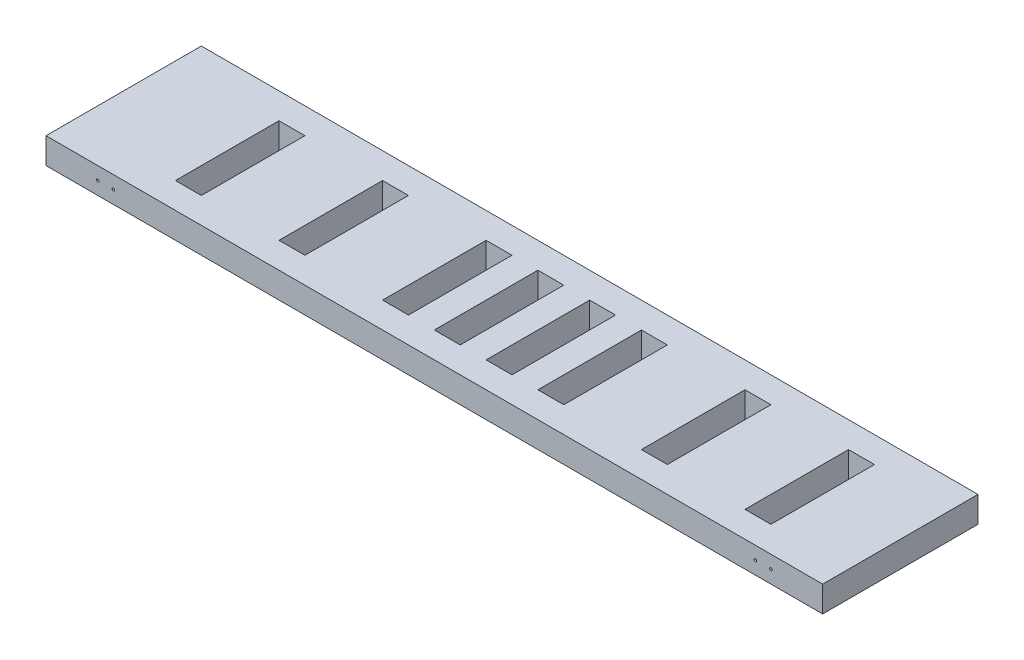
from build123d import *

# Parameters (mm, degrees)
SKETCH1_W           = 1500
SKETCH1_H           = 300
BOSS_EXTRUDE1_DEPTH = 50
SKETCH2_R           = 2.5
CUT_EXTRUDE1_DEPTH  = 50
SKETCH3_W           = 50
SKETCH3_H           = 200
CUT_EXTRUDE2_DEPTH  = 767.485485838


with BuildPart() as part:
    # Sketch1 → Boss-Extrude1 (new body)
    with BuildSketch(Plane(origin=(0, 0, 0), x_dir=(1, 0, 0), z_dir=(0, 1, 0))):
        Rectangle(SKETCH1_W, SKETCH1_H)
    extrude(amount=BOSS_EXTRUDE1_DEPTH)

    # Sketch2 → Cut-Extrude1 (cut)
    with BuildSketch(Plane.XY.offset(150)):
        with Locations((-650, 25)):
            Circle(SKETCH2_R)
        with Locations((-620, 25)):
            Circle(SKETCH2_R)
        with Locations((620, 25)):
            Circle(SKETCH2_R)
        with Locations((650, 25)):
            Circle(SKETCH2_R)
    extrude(amount=-CUT_EXTRUDE1_DEPTH, mode=Mode.SUBTRACT)

    # Sketch3 → Cut-Extrude2 (cut, through all)
    with BuildSketch(Plane(origin=(0, 50, 0), x_dir=(1, 0, 0), z_dir=(0, 1, 0))):
        with Locations((-525, 0)):
            Rectangle(SKETCH3_W, SKETCH3_H)
        with Locations((-325, 0)):
            Rectangle(SKETCH3_W, SKETCH3_H)
        with Locations((-125, 0)):
            Rectangle(SKETCH3_W, SKETCH3_H)
        with Locations((-25, 0)):
            Rectangle(SKETCH3_W, SKETCH3_H)
        with Locations((75, 0)):
            Rectangle(SKETCH3_W, SKETCH3_H)
        with Locations((175, 0)):
            Rectangle(SKETCH3_W, SKETCH3_H)
        with Locations((375, 0)):
            Rectangle(SKETCH3_W, SKETCH3_H)
        with Locations((575, 0)):
            Rectangle(SKETCH3_W, SKETCH3_H)
    extrude(amount=-CUT_EXTRUDE2_DEPTH, mode=Mode.SUBTRACT)


solid = part.part
